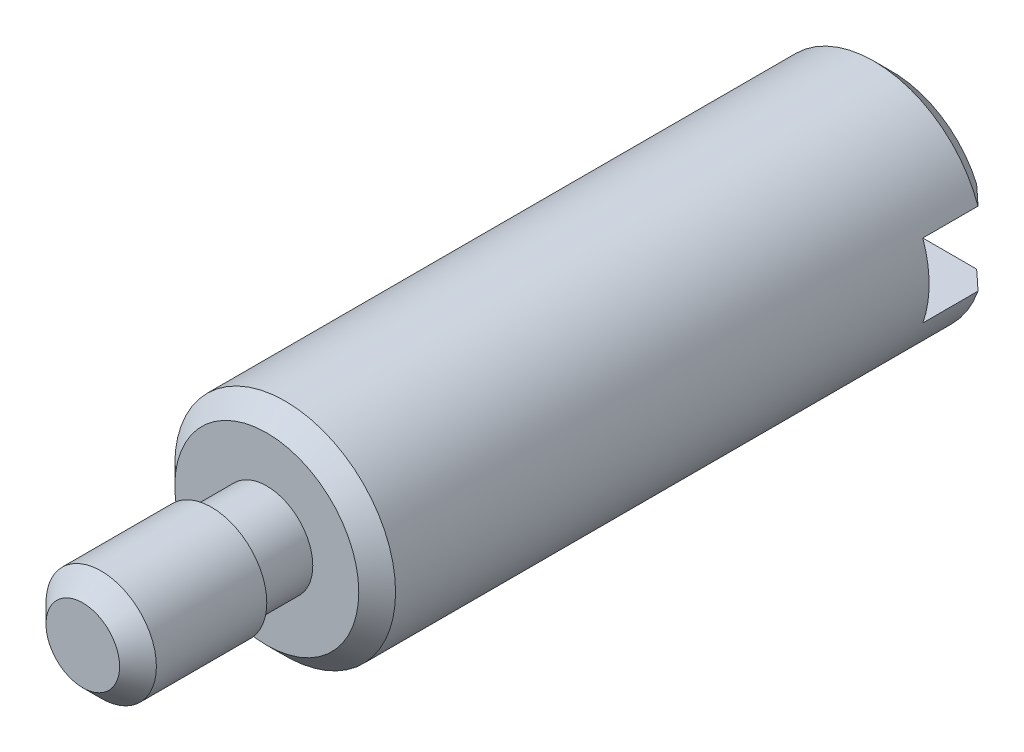
from build123d import *

# Parameters (mm, degrees)
SKETCH_1_R          = 3
EXTRUDE_1_DEPTH     = 17
SKETCH_2_R          = 1.5
EXTRUDE_2_DEPTH     = 5
CHAMFER_1_SIZE      = 0.5
SKETCH_3_R          = 1.5
SKETCH_3_R_2        = 1.25
CUT_EXTRUDE_3_DEPTH = 1.5
SKETCH_4_W          = 2
SKETCH_4_H          = 2
CUT_EXTRUDE_4_DEPTH = 10
CHAMFER_2_SIZE      = 0.5


with BuildPart() as part:
    # 草图1 → 拉伸1 (new body)
    with BuildSketch(Plane.XY):
        Circle(SKETCH_1_R)
    extrude(amount=EXTRUDE_1_DEPTH)

    # 草图2 → 拉伸2 (add)
    with BuildSketch(Plane.XY.offset(17)):
        Circle(SKETCH_2_R)
    extrude(amount=EXTRUDE_2_DEPTH)

    # 倒角1
    chamfer_1_edges = [part.edges().sort_by_distance(p)[0] for p in [
        (-1.5, 0, 22),
    ]]
    chamfer(chamfer_1_edges, length=CHAMFER_1_SIZE)

    # 草图3 → 拉伸3 (cut)
    with BuildSketch(Plane.XY.offset(17)):
        Circle(SKETCH_3_R)
        Circle(SKETCH_3_R_2, mode=Mode.SUBTRACT)
    extrude(amount=CUT_EXTRUDE_3_DEPTH, mode=Mode.SUBTRACT)

    # 草图4 → 拉伸4 (cut, symmetric)
    with BuildSketch(Plane(origin=(0, 0, 0), x_dir=(0, 0, -1), z_dir=(1, 0, 0))):
        with Locations((-1, 0)):
            Rectangle(SKETCH_4_W, SKETCH_4_H)
    extrude(amount=CUT_EXTRUDE_4_DEPTH, both=True, mode=Mode.SUBTRACT)

    # 倒角2
    chamfer_2_edges = [part.edges().sort_by_distance(p)[0] for p in [
        (0, 3, 0),
        (0, -3, 0),
        (-3, 0, 17),
    ]]
    chamfer(chamfer_2_edges, length=CHAMFER_2_SIZE)


solid = part.part
